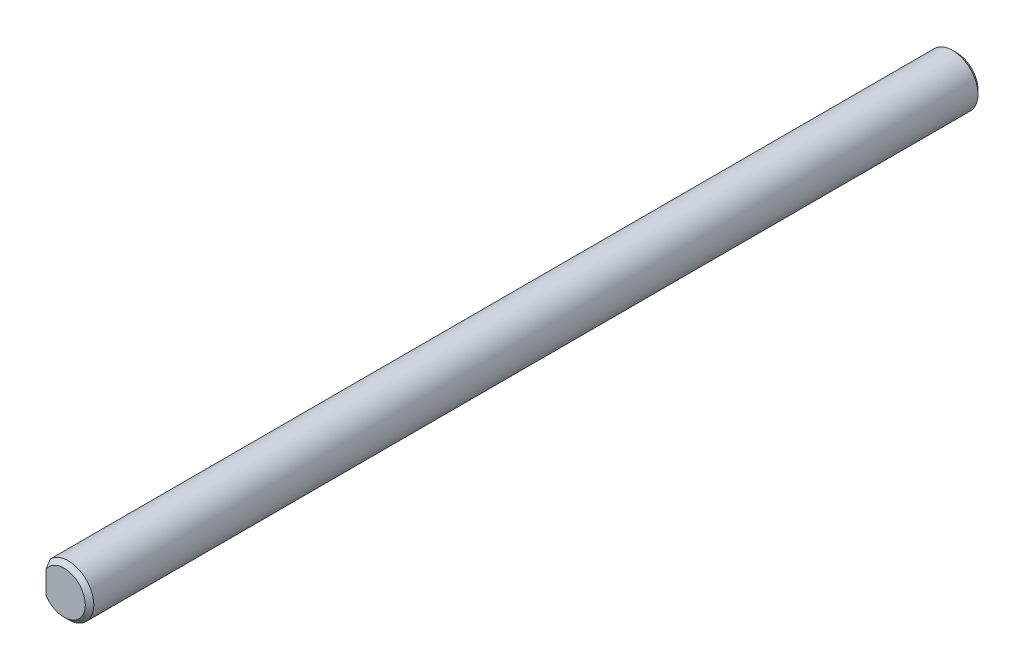
from build123d import *

# Parameters (mm, degrees)
SKETCH_1_R          = 3
EXTRUDE_1_DEPTH     = 105
CUT_EXTRUDE_1_DEPTH = 30
CUT_EXTRUDE_START   = -10
CUT_EXTRUDE_2_DEPTH = 10
M3X0_5_1_D          = 2.5
M3X0_5_1_DEPTH      = 10
M3X0_5_1_TIP        = 0.751075774
CHAMFER_1_SIZE      = 0.5


with BuildPart() as part:
    # 草图1 → 凸台-拉伸1 (new body)
    with BuildSketch(Plane.XY):
        Circle(SKETCH_1_R)
    extrude(amount=EXTRUDE_1_DEPTH)

    # 草图2 → 切除-拉伸1 (cut)
    with BuildSketch(Plane(origin=(0, 0, 0), x_dir=(-1, 0, 0), z_dir=(0, 0, -1))):
        with BuildLine():
            ThreePointArc((3, 0), (2.771638598, 1.148050297), (2.121320344, 2.121320344))
            Line((2.121320344, 2.121320344), (2.121320344, -2.121320344))
            ThreePointArc((2.121320344, -2.121320344), (2.771638598, -1.148050297), (3, 0))
        make_face()
    extrude(amount=-CUT_EXTRUDE_1_DEPTH, mode=Mode.SUBTRACT)

    # 草图3 → 切除-拉伸2 (cut)
    with BuildSketch(Plane.XY.offset(105).offset(CUT_EXTRUDE_START)):
        with BuildLine():
            Line((-2.121320344, -2.121320344), (-2.121320344, 2.121320344))
            ThreePointArc((-2.121320344, 2.121320344), (-3, 0), (-2.121320344, -2.121320344))
        make_face()
    extrude(amount=CUT_EXTRUDE_2_DEPTH, mode=Mode.SUBTRACT)

    # M3x0.5 螺纹孔1
    with Locations(Plane(origin=(0, 0, 0), x_dir=(-1, 0, 0), z_dir=(0, 0, -1))):
        with Locations((0, 0)):
            Hole(M3X0_5_1_D / 2, depth=M3X0_5_1_DEPTH)
            with Locations((0, 0, -(M3X0_5_1_DEPTH + M3X0_5_1_TIP / 2))):  # 118° drill point
                Cone(0, M3X0_5_1_D / 2, M3X0_5_1_TIP, mode=Mode.SUBTRACT)

    # 倒角1
    chamfer_1_edges = [part.edges().sort_by_distance(p)[0] for p in [
        (1.148050297, -2.771638598, 105),
        (1.148050297, 2.771638598, 0),
    ]]
    chamfer(chamfer_1_edges, length=CHAMFER_1_SIZE)


solid = part.part
